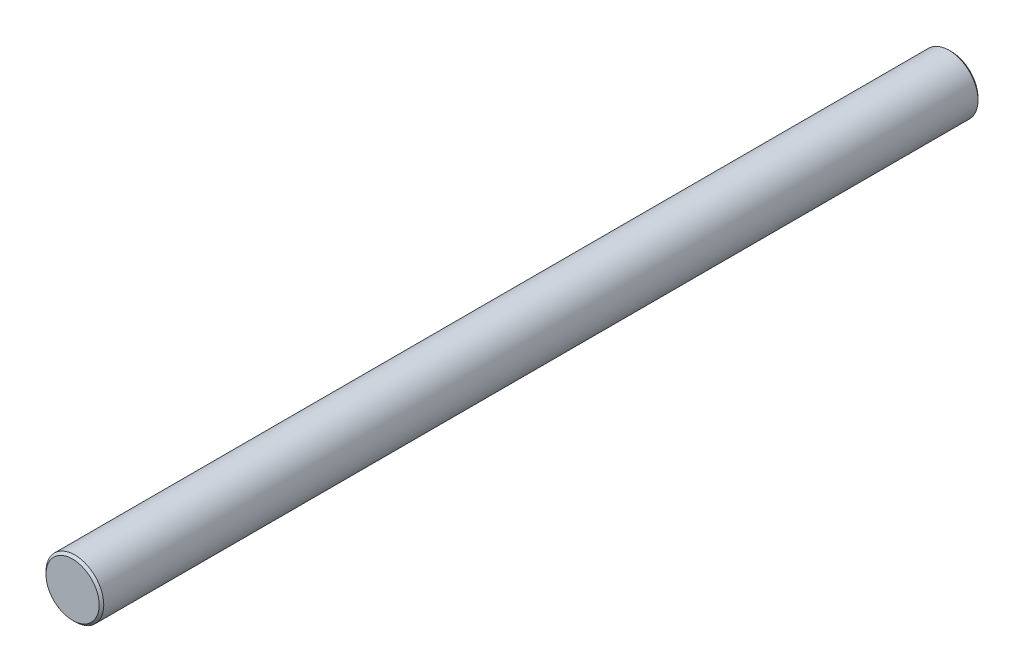
from build123d import *

# Parameters (mm, degrees)
SKETCH_1_R      = 12.5
EXTRUDE_1_DEPTH = 190
CHAMFER_1_SIZE  = 1


with BuildPart() as part:
    # Эскиз1 → Бобышка-Вытянуть1 (new, symmetric)
    with BuildSketch(Plane.XY):
        Circle(SKETCH_1_R)
    extrude(amount=EXTRUDE_1_DEPTH, both=True)

    # Фаска1
    chamfer_1_edges = [part.edges().sort_by_distance(p)[0] for p in [
        (-12.5, 0, -190),
        (-12.5, 0, 190),
    ]]
    chamfer(chamfer_1_edges, length=CHAMFER_1_SIZE)


solid = part.part
